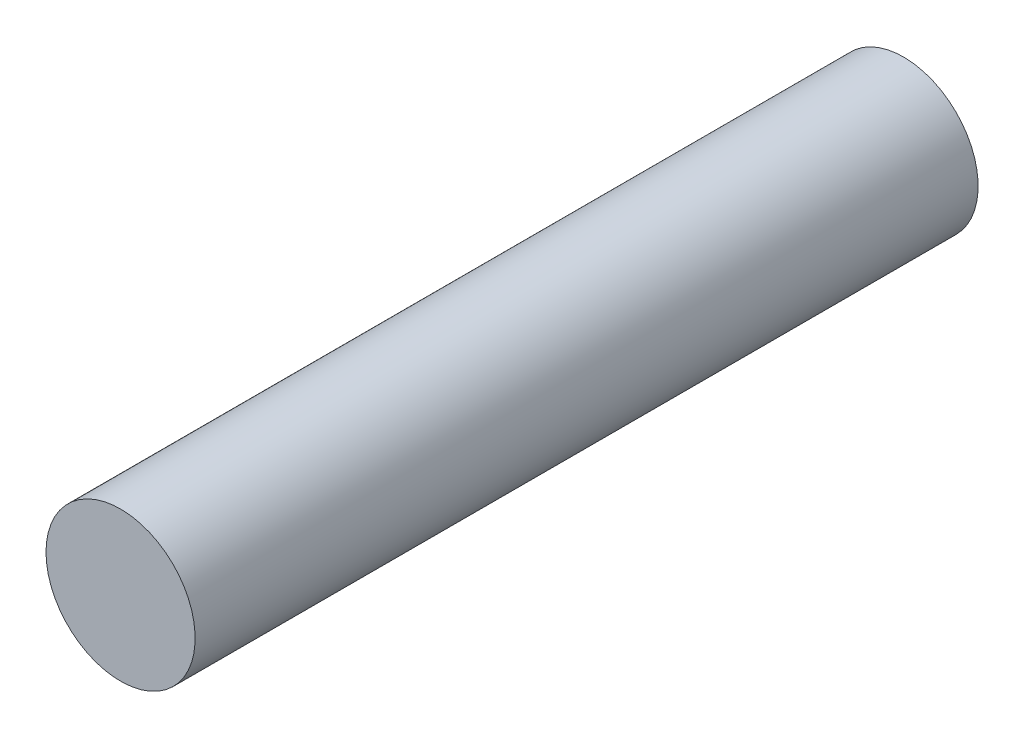
from build123d import *

# Parameters (mm, degrees)
SKETCH1_R           = 4
BOSS_EXTRUDE1_DEPTH = 21


with BuildPart() as part:
    # Sketch1 → Boss-Extrude1 (new, symmetric)
    with BuildSketch(Plane.XY):
        with Locations(Location((0, 0, 0), (0, 0, 180))):
            Circle(SKETCH1_R)
    extrude(amount=BOSS_EXTRUDE1_DEPTH, both=True)


solid = part.part
